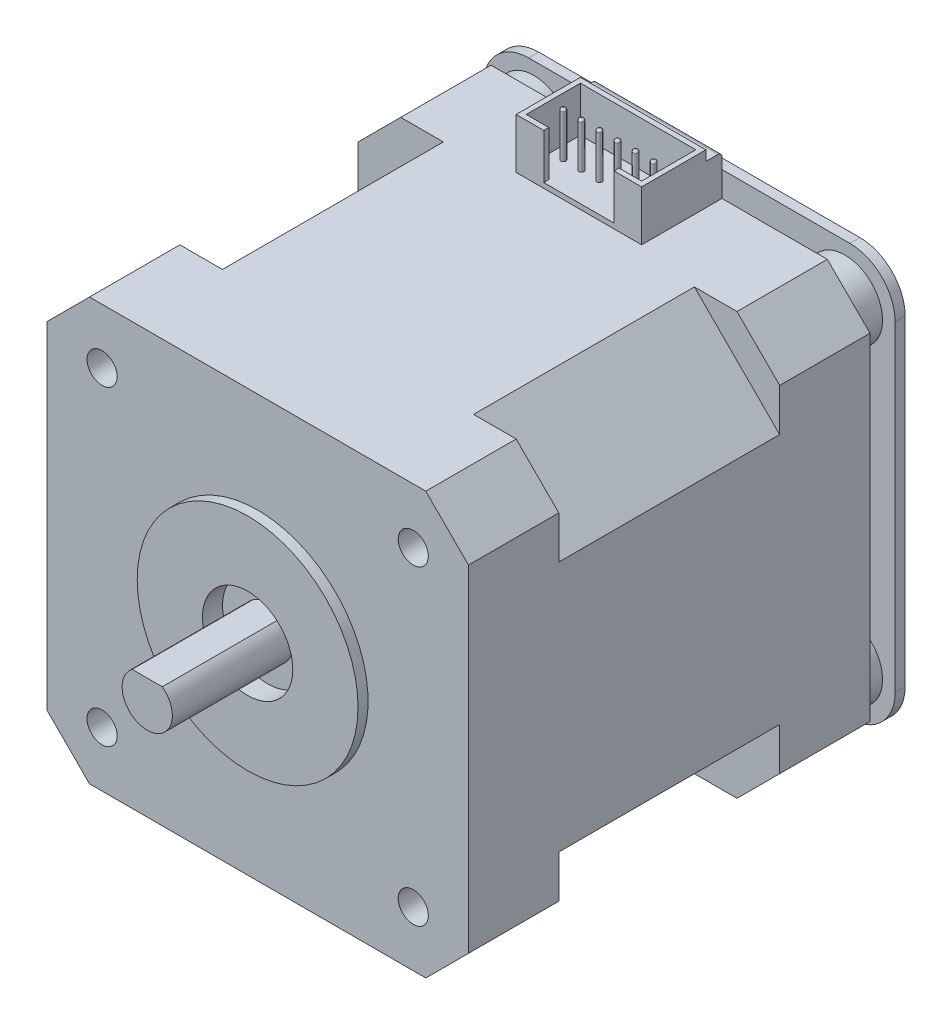
from build123d import *

# Parameters (mm, degrees)
EXTRUDE_1_DEPTH          = 20
SKETCH_3_R               = 11
EXTRUDE_2_DEPTH          = 1
SKETCH_4_R               = 4.5
CUT_EXTRUDE_1_DEPTH      = 2
SKETCH_5_R               = 2.5
EXTRUDE_3_DEPTH          = 12
CUT_EXTRUDE_2_DEPTH      = 24
SKETCH_7_R               = 3
CUT_EXTRUDE_3_DEPTH      = 2
SKETCH_8_R               = 1.75
EXTRUDE_4_DEPTH          = 1
SKETCH_9_R               = 1.5
CUT_EXTRUDE_4_DEPTH      = 5
SKETCH_13_W              = 16
SKETCH_13_H              = 22
CUT_EXTRUDE_5_DEPTH      = 62.738809959
PATTERN_CIRCULAR_1_COUNT = 4
SKETCH_12_R              = 3.75
EXTRUDE_5_DEPTH          = 3
EXTRUDE_START            = 3
EXTRUDE_6_DEPTH          = 1
SKETCH_17_W              = 12.5
SKETCH_17_H              = 8
EXTRUDE_7_DEPTH          = 5
SKETCH_20_W              = 1.6
SKETCH_20_H              = 1
CUT_EXTRUDE_6_DEPTH      = 49.780759527
FILLET_1_R               = 0.4
SKETCH_21_W              = 11.5
SKETCH_21_H              = 5.4
CUT_EXTRUDE_7_DEPTH      = 4.5
SKETCH_22_W              = 7
SKETCH_22_H              = 0.5
CUT_EXTRUDE_8_DEPTH      = 4.5
SKETCH_23_W              = 10
SKETCH_23_H              = 22.7
EXTRUDE_8_DEPTH          = 6.5
SKETCH_24_W              = 5.5
SKETCH_24_H              = 21.7
CUT_EXTRUDE_9_DEPTH      = 8
SKETCH_25_W              = 0.5
SKETCH_25_H              = 13
CUT_EXTRUDE_10_DEPTH     = 8
SKETCH_26_R              = 0.25
EXTRUDE_10_DEPTH         = 8
SKETCH_27_R              = 0.25
EXTRUDE_11_DEPTH         = 4.5
FILLET_2_R               = 0.2
FILLET_3_R               = 0.2


with BuildPart() as part:
    # 草图1 → 凸台-拉伸1 (new, symmetric)
    with BuildSketch(Plane.XY):
        Polygon((21, 16.75), (21, -16.75), (16.75, -21), (-16.75, -21), (-21, -16.75), (-21, 16.75), (-16.75, 21), (16.75, 21), align=None)
    extrude(amount=EXTRUDE_1_DEPTH, both=True)

    # 草图3 → 凸台-拉伸2 (add, symmetric)
    with BuildSketch(Plane.XY.offset(20)):
        Circle(SKETCH_3_R)
    extrude(amount=EXTRUDE_2_DEPTH, both=True)

    # 草图4 → 切除-拉伸1 (cut)
    with BuildSketch(Plane.XY.offset(21)):
        Circle(SKETCH_4_R)
    extrude(amount=-CUT_EXTRUDE_1_DEPTH, mode=Mode.SUBTRACT)

    # 草图5 → 凸台-拉伸3 (add, symmetric)
    with BuildSketch(Plane.XY.offset(19)):
        Circle(SKETCH_5_R)
    extrude(amount=EXTRUDE_3_DEPTH, both=True)

    # 草图6 → 切除-拉伸2 (cut)
    with BuildSketch(Plane.XY.offset(31)):
        with BuildLine():
            Line((-1.5, 2), (1.5, 2))
            ThreePointArc((1.5, 2), (0, 2.5), (-1.5, 2))
        make_face()
    extrude(amount=-CUT_EXTRUDE_2_DEPTH, mode=Mode.SUBTRACT)

    # 草图7 → 切除-拉伸3 (cut)
    with BuildSketch(Plane(origin=(0, 0, -20), x_dir=(-1, 0, 0), z_dir=(0, 0, -1))):
        Circle(SKETCH_7_R)
    extrude(amount=-CUT_EXTRUDE_3_DEPTH, mode=Mode.SUBTRACT)

    # 草图8 → 凸台-拉伸4 (add)
    with BuildSketch(Plane(origin=(0, 0, -18), x_dir=(-1, 0, 0), z_dir=(0, 0, -1))):
        Circle(SKETCH_8_R)
    extrude(amount=EXTRUDE_4_DEPTH)

    # 草图9 → 切除-拉伸4 (cut)
    with BuildSketch(Plane.XY.offset(20)):
        with Locations((15.5, 15.5)):
            Circle(SKETCH_9_R)
        with Locations((15.5, -15.5)):
            Circle(SKETCH_9_R)
        with Locations((-15.5, -15.5)):
            Circle(SKETCH_9_R)
        with Locations((-15.5, 15.5)):
            Circle(SKETCH_9_R)
    extrude(amount=-CUT_EXTRUDE_4_DEPTH, mode=Mode.SUBTRACT)

    # 草图13 → 切除-拉伸5 (cut, through all)
    with BuildSketch(Plane(origin=(16.753679656, 16.753679656, 0), x_dir=(0.707106781186548, -0.7071067811865471, 0), z_dir=(0.7071067811865471, 0.707106781186548, 0))):
        Rectangle(SKETCH_13_W, SKETCH_13_H)
    cut_extrude_5 = extrude(amount=CUT_EXTRUDE_5_DEPTH, mode=Mode.SUBTRACT)

    # 阵列(圆周)1: 切除-拉伸5 ×4 about axis
    pattern_circular_1_axis = Axis((0, 0, 0), (0, 0, 1))
    for i in range(1, PATTERN_CIRCULAR_1_COUNT):
        add(cut_extrude_5.rotate(pattern_circular_1_axis, i * 360 / PATTERN_CIRCULAR_1_COUNT), mode=Mode.SUBTRACT)

    # 草图12 → 凸台-拉伸5 (add)
    with BuildSketch(Plane(origin=(0, 0, -20), x_dir=(-1, 0, 0), z_dir=(0, 0, -1))):
        with Locations((15.5, 15.5)):
            Circle(SKETCH_12_R)
        with Locations((15.5, -15.5)):
            Circle(SKETCH_12_R)
        with Locations((-15.5, -15.5)):
            Circle(SKETCH_12_R)
        with Locations((-15.5, 15.5)):
            Circle(SKETCH_12_R)
    extrude(amount=EXTRUDE_5_DEPTH)

    # 草图15 → 凸台-拉伸6 (add)
    with BuildSketch(Plane(origin=(0, 0, -20), x_dir=(-1, 0, 0), z_dir=(0, 0, -1)).offset(EXTRUDE_START)):
        with BuildLine():
            Line((-16, 20.5), (16, 20.5))
            ThreePointArc((16, 20.5), (19.181980515, 19.181980515), (20.5, 16))
            Line((20.5, 16), (20.5, -16))
            ThreePointArc((20.5, -16), (19.181980515, -19.181980515), (16, -20.5))
            Line((16, -20.5), (-16, -20.5))
            ThreePointArc((-16, -20.5), (-19.181980515, -19.181980515), (-20.5, -16))
            Line((-20.5, -16), (-20.5, 16))
            ThreePointArc((-20.5, 16), (-19.181980515, 19.181980515), (-16, 20.5))
        make_face()
    extrude(amount=EXTRUDE_6_DEPTH)

    # 草图17 → 凸台-拉伸7 (add)
    with BuildSketch(Plane(origin=(0, 21, 0), x_dir=(1, 0, 0), z_dir=(0, 1, 0))):
        with Locations((0, 16)):
            Rectangle(SKETCH_17_W, SKETCH_17_H)
    extrude(amount=EXTRUDE_7_DEPTH)

    # 草图20 → 切除-拉伸6 (cut, through all)
    with BuildSketch(Plane(origin=(6.25, 0, 0), x_dir=(0, 0, -1), z_dir=(1, 0, 0))):
        with Locations((19.2, 25.5)):
            Rectangle(SKETCH_20_W, SKETCH_20_H)
    extrude(amount=-CUT_EXTRUDE_6_DEPTH, mode=Mode.SUBTRACT)

    # 圆角1
    fillet_1_edges = [part.edges().sort_by_distance(p)[0] for p in [
        (0, 25, -20),
    ]]
    fillet(fillet_1_edges, radius=FILLET_1_R)

    # 草图21 → 切除-拉伸7 (cut)
    with BuildSketch(Plane(origin=(0, 26, 0), x_dir=(1, 0, 0), z_dir=(0, 1, 0))):
        with Locations((0, 15.2)):
            Rectangle(SKETCH_21_W, SKETCH_21_H)
    extrude(amount=-CUT_EXTRUDE_7_DEPTH, mode=Mode.SUBTRACT)

    # 草图22 → 切除-拉伸8 (cut)
    with BuildSketch(Plane(origin=(0, 26, 0), x_dir=(1, 0, 0), z_dir=(0, 1, 0))):
        with Locations((0, 12.25)):
            Rectangle(SKETCH_22_W, SKETCH_22_H)
    extrude(amount=-CUT_EXTRUDE_8_DEPTH, mode=Mode.SUBTRACT)

    # 草图23 → 凸台-拉伸8 (add)
    with BuildSketch(Plane(origin=(0, 0, -24), x_dir=(-1, 0, 0), z_dir=(0, 0, -1))):
        with Locations((19.5, 0)):
            Rectangle(SKETCH_23_W, SKETCH_23_H)
    extrude(amount=EXTRUDE_8_DEPTH)

    # 草图24 → 切除-拉伸9 (cut)
    with BuildSketch(Plane.ZY.offset(24.5)):
        with Locations((-27.25, 0)):
            Rectangle(SKETCH_24_W, SKETCH_24_H)
    extrude(amount=-CUT_EXTRUDE_9_DEPTH, mode=Mode.SUBTRACT)

    # 草图25 → 切除-拉伸10 (cut)
    with BuildSketch(Plane.ZY.offset(24.5)):
        with Locations((-30.25, 0)):
            Rectangle(SKETCH_25_W, SKETCH_25_H)
    extrude(amount=-CUT_EXTRUDE_10_DEPTH, mode=Mode.SUBTRACT)

    # 草图26 → 凸台-拉伸10 (add)
    with BuildSketch(Plane.ZY.offset(16.5)):
        with Locations((-27.5, 6.5)):
            Circle(SKETCH_26_R)
        with Locations((-27.5, 3.9)):
            Circle(SKETCH_26_R)
        with Locations((-27.5, 1.3)):
            Circle(SKETCH_26_R)
        with Locations((-27.5, 9.1)):
            Circle(SKETCH_26_R)
        with Locations((-27.5, -1.3)):
            Circle(SKETCH_26_R)
        with Locations((-27.5, -3.9)):
            Circle(SKETCH_26_R)
        with Locations((-27.5, -6.5)):
            Circle(SKETCH_26_R)
        with Locations((-27.5, -9.1)):
            Circle(SKETCH_26_R)
    extrude(amount=EXTRUDE_10_DEPTH)

    # 草图27 → 凸台-拉伸11 (add)
    with BuildSketch(Plane(origin=(0, 21.5, 0), x_dir=(1, 0, 0), z_dir=(0, 1, 0))):
        with Locations((0.9, 14.95)):
            Circle(SKETCH_27_R)
        with Locations((2.7, 14.95)):
            Circle(SKETCH_27_R)
        with Locations((4.5, 14.95)):
            Circle(SKETCH_27_R)
        with Locations((-4.5, 14.95)):
            Circle(SKETCH_27_R)
        with Locations((-2.7, 14.95)):
            Circle(SKETCH_27_R)
        with Locations((-0.9, 14.95)):
            Circle(SKETCH_27_R)
    extrude(amount=EXTRUDE_11_DEPTH)

    # 圆角2
    fillet_2_edges = [part.edges().sort_by_distance(p)[0] for p in [
        (-24.5, -9.1, -27.75),
        (-24.5, -6.5, -27.75),
        (-24.5, -3.9, -27.75),
        (-24.5, -1.3, -27.75),
        (-24.5, 1.3, -27.75),
        (-24.5, 3.9, -27.75),
        (-24.5, 6.5, -27.75),
        (-24.5, 9.1, -27.75),
    ]]
    fillet(fillet_2_edges, radius=FILLET_2_R)

    # 圆角3
    fillet_3_edges = [part.edges().sort_by_distance(p)[0] for p in [
        (-4.75, 26, -14.95),
        (-2.95, 26, -14.95),
        (-1.15, 26, -14.95),
        (0.65, 26, -14.95),
        (2.45, 26, -14.95),
        (4.25, 26, -14.95),
    ]]
    fillet(fillet_3_edges, radius=FILLET_3_R)


solid = part.part
